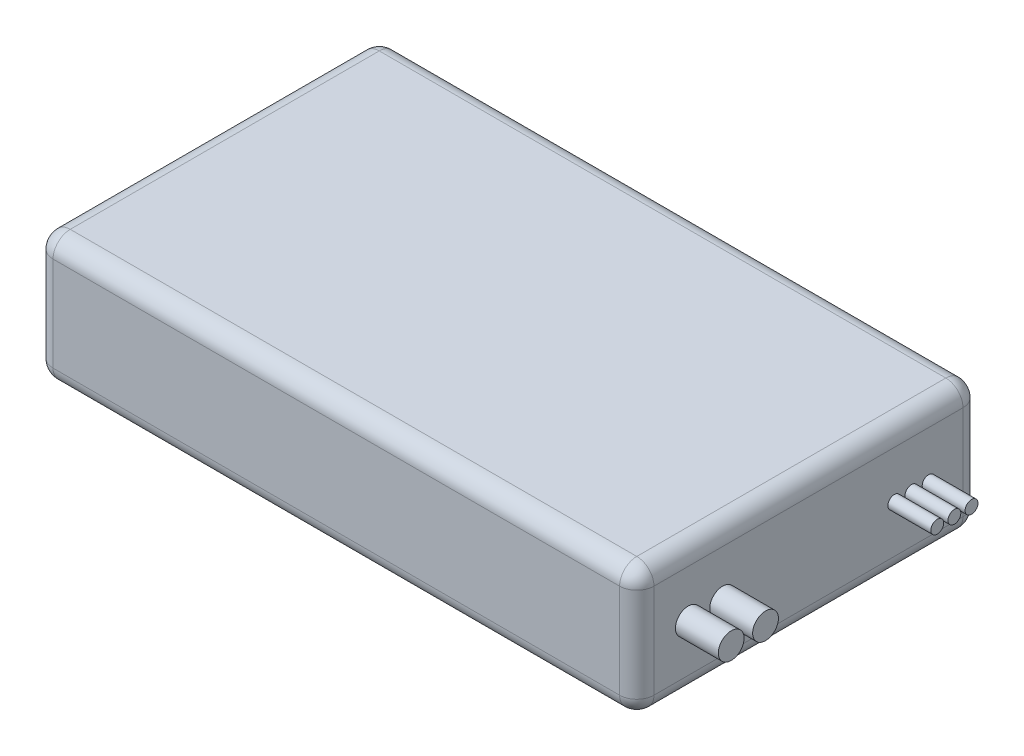
from build123d import *

# Parameters (mm, degrees)
ESQUISSE1_W      = 70
ESQUISSE1_H      = 40
EXTRUSION1_DEPTH = 15
CONG_1_R         = 2
ESQUISSE2_R      = 1.5
ESQUISSE2_R_2    = 0.75
EXTRUSION2_DEPTH = 5


with BuildPart() as part:
    # Esquisse1 → Extrusion1 (new body)
    with BuildSketch(Plane(origin=(0, 0, 0), x_dir=(1, 0, 0), z_dir=(0, 1, 0))):
        with Locations((35, 20)):
            Rectangle(ESQUISSE1_W, ESQUISSE1_H)
    extrude(amount=EXTRUSION1_DEPTH)

    # Congé1
    cong_1_edges = [part.edges().sort_by_distance(p)[0] for p in [
        (70, 15, -20),
        (35, 15, -40),
        (0, 15, -20),
        (35, 0, -40),
        (70, 0, -20),
        (35, 0, 0),
        (0, 0, -20),
        (35, 15, 0),
        (0, 7.5, -40),
        (70, 7.5, -40),
        (70, 7.5, 0),
        (0, 7.5, 0),
    ]]
    fillet(cong_1_edges, radius=CONG_1_R)

    # Esquisse2 → Extrusion2 (add)
    with BuildSketch(Plane(origin=(70, 0, 0), x_dir=(0, 0, -1), z_dir=(1, 0, 0))):
        with Locations(Location((6, 7.5, 0), (0, 0, 180))):
            Circle(ESQUISSE2_R)
        with Locations(Location((10, 7.5, 0), (0, 0, 180))):
            Circle(ESQUISSE2_R)
        with Locations(Location((30, 7.5, 0), (0, 0, 180))):
            Circle(ESQUISSE2_R_2)
        with Locations(Location((32, 7.5, 0), (0, 0, 180))):
            Circle(ESQUISSE2_R_2)
        with Locations(Location((34, 7.5, 0), (0, 0, 180))):
            Circle(ESQUISSE2_R_2)
    extrude(amount=EXTRUSION2_DEPTH)


solid = part.part
